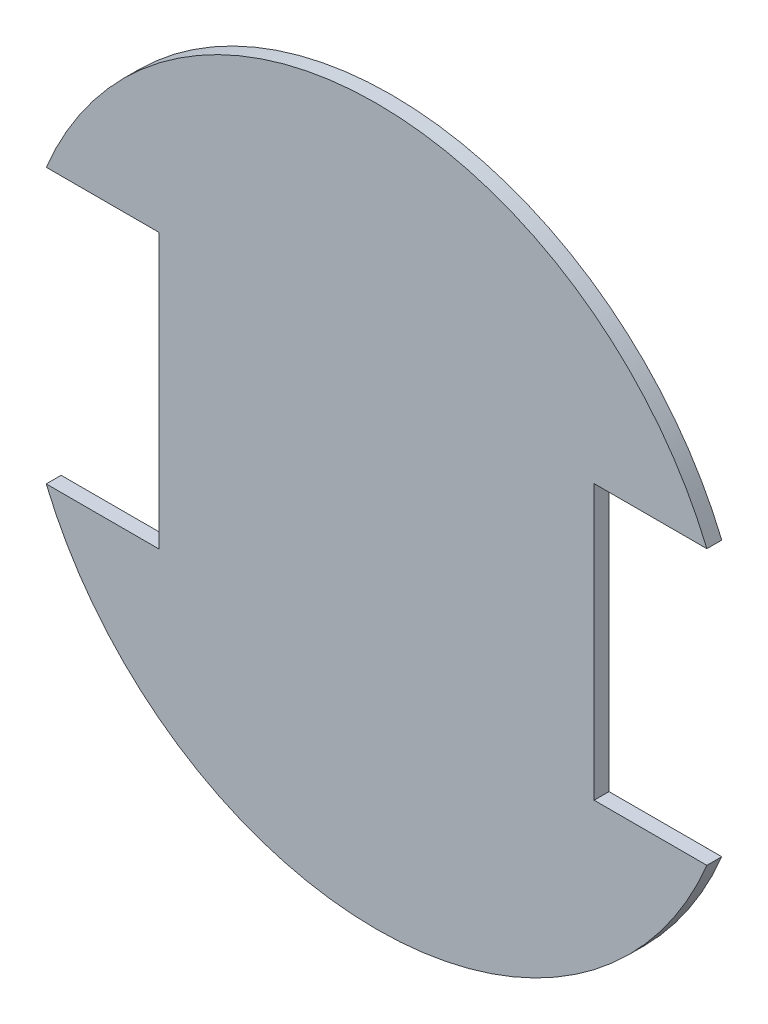
from build123d import *

# Parameters (mm, degrees)
BOSS_EXTRUDE1_DEPTH = 5


with BuildPart() as part:
    # Sketch1 → Boss-Extrude1 (new body)
    with BuildSketch(Plane.XY):
        with BuildLine():
            Line((73, -46), (73, 46))
            Line((73, 46), (110.83320802, 46))
            ThreePointArc((110.83320802, 46), (0, 120), (-110.83320802, 46))
            Line((-110.83320802, 46), (-73, 46))
            Line((-73, 46), (-73, -46))
            Line((-73, -46), (-110.83320802, -46))
            ThreePointArc((-110.83320802, -46), (0, -120), (110.83320802, -46))
            Line((110.83320802, -46), (73, -46))
        make_face()
    extrude(amount=BOSS_EXTRUDE1_DEPTH)


solid = part.part
